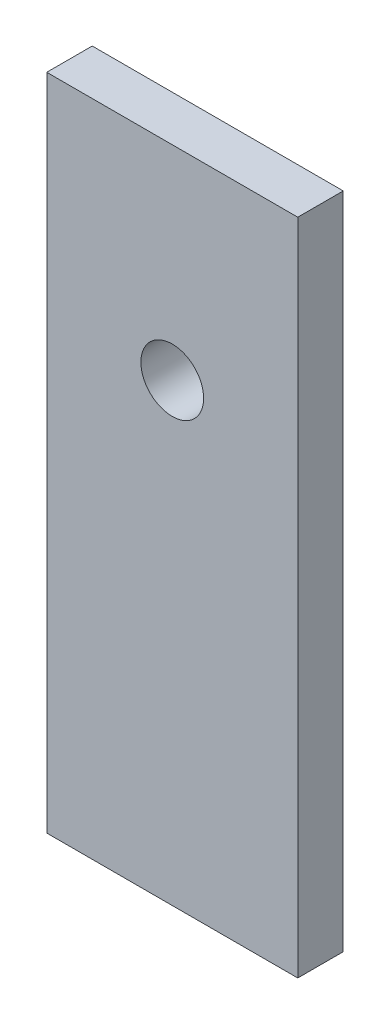
from build123d import *

# Parameters (mm, degrees)
SKETCH_1_W      = 32
SKETCH_1_H      = 84
SKETCH_1_R      = 4
EXTRUDE_1_DEPTH = 5.8


with BuildPart() as part:
    # Эскиз1 → Бобышка-Вытянуть1 (new body)
    with BuildSketch(Plane.XY):
        with Locations((16, 42)):
            Rectangle(SKETCH_1_W, SKETCH_1_H)
        with Locations((16, 58)):
            Circle(SKETCH_1_R, mode=Mode.SUBTRACT)
    extrude(amount=EXTRUDE_1_DEPTH)


solid = part.part
